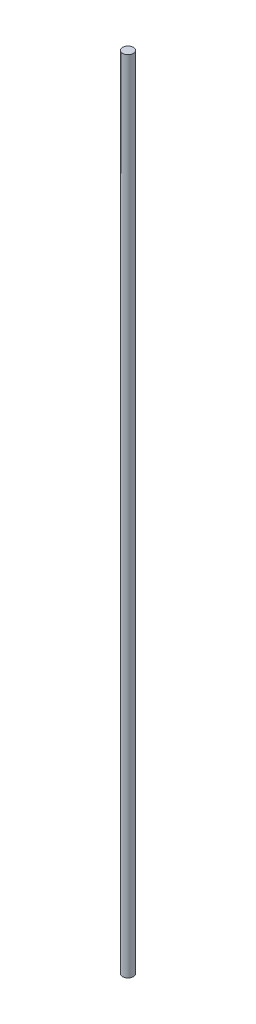
from build123d import *

# Parameters (mm, degrees)
SKETCH1_R      = 4
EXTRUDE1_DEPTH = 600


with BuildPart() as part:
    # Sketch1 → Extrude1 (new body)
    with BuildSketch(Plane(origin=(0, 0, 0), x_dir=(1, 0, 0), z_dir=(0, 1, 0))):
        with Locations(Location((0, 0, 0), (0, 0, 270))):
            Circle(SKETCH1_R)
    extrude(amount=EXTRUDE1_DEPTH)


solid = part.part
